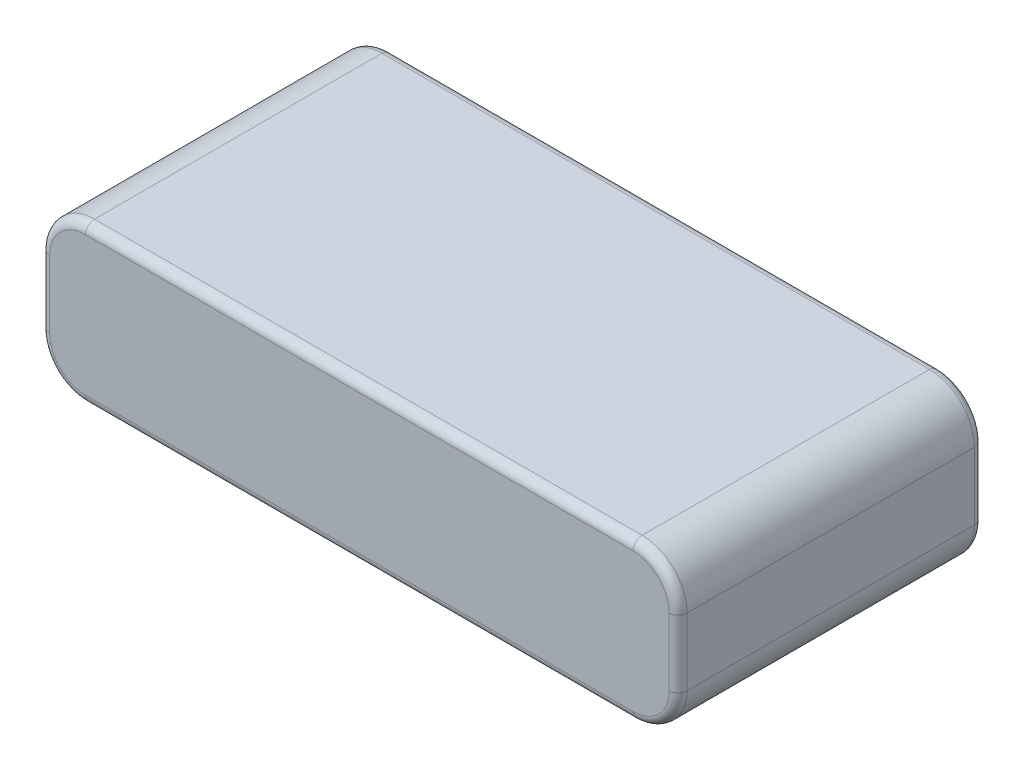
from build123d import *

# Parameters (mm, degrees)
SKETCH2_W           = 71
SKETCH2_H           = 34
BOSS_EXTRUDE1_DEPTH = 17.5
FILLET1_R           = 5
FILLET2_R           = 1


with BuildPart() as part:
    # Sketch2 → Boss-Extrude1 (new body)
    with BuildSketch(Plane(origin=(0, 0, 0), x_dir=(1, 0, 0), z_dir=(0, 1, 0))):
        Rectangle(SKETCH2_W, SKETCH2_H)
    extrude(amount=BOSS_EXTRUDE1_DEPTH)

    # Fillet1
    fillet1_edges = [part.edges().sort_by_distance(p)[0] for p in [
        (-35.5, 17.5, 0),
        (35.5, 17.5, 0),
        (-35.5, 0, 0),
        (35.5, 0, 0),
    ]]
    fillet(fillet1_edges, radius=FILLET1_R)

    # Fillet2
    fillet2_edges = [part.edges().sort_by_distance(p)[0] for p in [
        (-35.5, 8.75, 17),
        (-35.5, 8.75, -17),
        (0, 0, 17),
        (35.5, 8.75, 17),
        (0, 17.5, 17),
        (-34.035533906, 16.035533906, 17),
        (34.035533906, 16.035533906, 17),
        (34.035533906, 1.464466094, 17),
        (-34.035533906, 1.464466094, 17),
        (0, 0, -17),
        (0, 17.5, -17),
        (35.5, 8.75, -17),
        (-34.035533906, 16.035533906, -17),
        (34.035533906, 16.035533906, -17),
        (34.035533906, 1.464466094, -17),
        (-34.035533906, 1.464466094, -17),
    ]]
    fillet(fillet2_edges, radius=FILLET2_R)


solid = part.part
